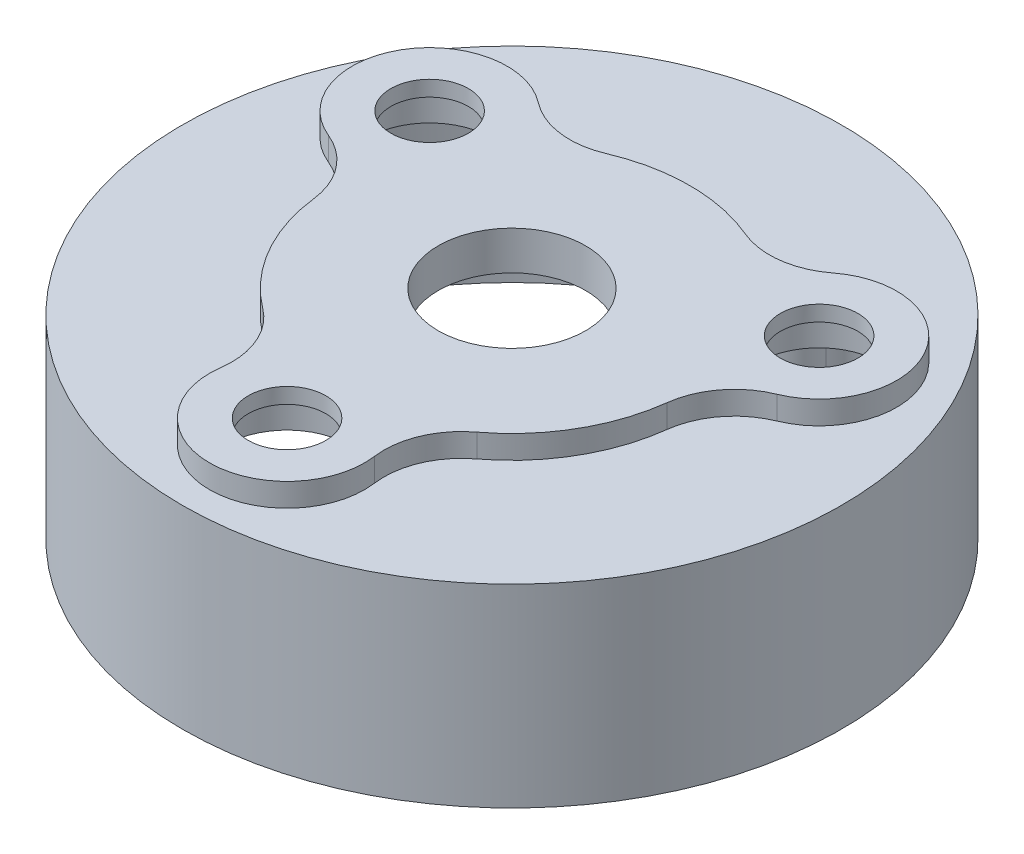
from build123d import *

# Parameters (mm, degrees)
SKETCH1_R                = 42.5
BOSS_EXTRUDE1_DEPTH      = 25
SKETCH2_R                = 22.945
BOSS_EXTRUDE2_DEPTH      = 3
SKETCH3_R                = 9.5
CUT_EXTRUDE1_DEPTH       = 99
SKETCH4_R                = 40.5
CUT_EXTRUDE2_DEPTH       = 23
BOSS_EXTRUDE5_DEPTH      = 2
BOSS_EXTRUDE5_DEPTH_BACK = 5
SKETCH6_R                = 10
CUT_EXTRUDE5_START       = 5
SKETCH8_R                = 8
CUT_EXTRUDE5_DEPTH       = 8
SKETCH9_R                = 5
CUT_EXTRUDE6_DEPTH       = 3
FILLET1_R                = 10
CUT_EXTRUDE3_DEPTH       = 65.354487155
CUT_EXTRUDE3_DEPTH_BACK  = 3
SKETCH5_R                = 20
SKETCH5_R_2              = 12.5
SKETCH12_R               = 6
SKETCH12_R_2             = 2
BOSS_EXTRUDE6_DEPTH      = 23
FILLET2_R                = 5


with BuildPart() as part:
    # Sketch1 → Boss-Extrude1 (new body)
    with BuildSketch(Plane(origin=(0, 0, 0), x_dir=(1, 0, 0), z_dir=(0, 1, 0))):
        with Locations(Location((0, 0, 0), (0, 0, 270))):
            Circle(SKETCH1_R)
    extrude(amount=BOSS_EXTRUDE1_DEPTH)

    # Sketch2 → Boss-Extrude2 (add)
    with BuildSketch(Plane(origin=(0, 25, 0), x_dir=(1, 0, 0), z_dir=(0, 1, 0))):
        with Locations(Location((0, 0, 0), (0, 0, 270))):
            Circle(SKETCH2_R)
    extrude(amount=BOSS_EXTRUDE2_DEPTH)

    # Sketch3 → Cut-Extrude1 (cut)
    with BuildSketch(Plane(origin=(0, 28, 0), x_dir=(1, 0, 0), z_dir=(0, 1, 0))):
        with Locations(Location((0, 0, 0), (0, 0, 270))):
            Circle(SKETCH3_R)
    extrude(amount=-CUT_EXTRUDE1_DEPTH, mode=Mode.SUBTRACT)

    # Sketch4 → Cut-Extrude2 (cut)
    with BuildSketch(Plane.XZ):
        with Locations(Location((0, 0, 0), (0, 0, 270))):
            Circle(SKETCH4_R)
    extrude(amount=-CUT_EXTRUDE2_DEPTH, mode=Mode.SUBTRACT)

    # Sketch6 → Boss-Extrude5 (add, two sides: drawn at the far end of the back side and taken through both)
    with BuildSketch(Plane(origin=(0, 23, 0), x_dir=(-1, 0, 0), z_dir=(0, -1, 0)).offset(-BOSS_EXTRUDE5_DEPTH_BACK)):
        with Locations(Location((25.11473671, 14.5, 0), (0, 0, 270))):
            Circle(SKETCH6_R)
        with Locations(Location((-25.11473671, 14.5, 0), (0, 0, 270))):
            Circle(SKETCH6_R)
        with Locations(Location((0, -29, 0), (0, 0, 270))):
            Circle(SKETCH6_R)
    extrude(amount=BOSS_EXTRUDE5_DEPTH + BOSS_EXTRUDE5_DEPTH_BACK)

    # Sketch8 → Cut-Extrude5 (cut)
    with BuildSketch(Plane.XZ.offset(-23).offset(CUT_EXTRUDE5_START)):
        with Locations(Location((0, 29, 0), (0, 0, 270))):
            Circle(SKETCH8_R)
        with Locations(Location((25.11473671, -14.5, 0), (0, 0, 270))):
            Circle(SKETCH8_R)
        with Locations(Location((-25.11473671, -14.5, 0), (0, 0, 270))):
            Circle(SKETCH8_R)
    extrude(amount=-CUT_EXTRUDE5_DEPTH, mode=Mode.SUBTRACT)

    # Sketch9 → Cut-Extrude6 (cut)
    with BuildSketch(Plane(origin=(0, 28, 0), x_dir=(1, 0, 0), z_dir=(0, 1, 0))):
        with Locations(Location((-25.11473671, 14.5, 0), (0, 0, 270))):
            Circle(SKETCH9_R)
        with Locations(Location((25.11473671, 14.5, 0), (0, 0, 270))):
            Circle(SKETCH9_R)
        with Locations(Location((0, -29, 0), (0, 0, 270))):
            Circle(SKETCH9_R)
    extrude(amount=-CUT_EXTRUDE6_DEPTH, mode=Mode.SUBTRACT)

    # Fillet1
    fillet1_edges = [part.edges().sort_by_distance(p)[0] for p in [
        (-15.428091514, 26.5, -16.983728014),
        (-22.422385668, 26.5, -4.869255176),
        (-6.994294154, 26.5, 21.85298319),
        (6.994294154, 26.5, 21.85298319),
        (22.422385668, 26.5, -4.869255176),
        (15.428091514, 26.5, -16.983728014),
    ]]
    fillet(fillet1_edges, radius=FILLET1_R)

    # Sketch5 → Cut-Extrude3 (cut, two sides: drawn at the far end of the back side and taken through both)
    with BuildSketch(Plane.XZ.offset(-23).offset(-CUT_EXTRUDE3_DEPTH_BACK)):
        with Locations(Location((0, 0, 0), (0, 0, 79.61563341))):
            Circle(SKETCH5_R)
        with Locations(Location((0, 0, 0), (0, 0, 90))):
            Circle(SKETCH5_R_2, mode=Mode.SUBTRACT)
    extrude(amount=CUT_EXTRUDE3_DEPTH + CUT_EXTRUDE3_DEPTH_BACK, mode=Mode.SUBTRACT)

    # Sketch12 → Boss-Extrude6 (add)
    # profile 1 of 3: a face of its own
    with BuildSketch(Plane.XZ.offset(-23)):
        with Locations((0, -35.5)):
            Circle(SKETCH12_R)
        with Locations(Location((0, -35.5, 0), (0, 0, 90))):
            Circle(SKETCH12_R_2, mode=Mode.SUBTRACT)
    # profile 2 of 3: a face of its own
    with BuildSketch(Plane.XZ.offset(-23)):
        with Locations((-30.743901834, 17.75)):
            Circle(SKETCH12_R)
        with Locations(Location((-30.743901834, 17.75, 0), (0, 0, 90))):
            Circle(SKETCH12_R_2, mode=Mode.SUBTRACT)
    # profile 3 of 3: a face of its own
    with BuildSketch(Plane.XZ.offset(-23)):
        with Locations((30.743901834, 17.75)):
            Circle(SKETCH12_R)
        with Locations(Location((30.743901834, 17.75, 0), (0, 0, 90))):
            Circle(SKETCH12_R_2, mode=Mode.SUBTRACT)
    extrude(amount=BOSS_EXTRUDE6_DEPTH)

    # Fillet2
    fillet2_edges = [part.edges().sort_by_distance(p)[0] for p in [
        (-3.539109012, 11.5, -40.345070423),
        (3.539109012, 11.5, -40.345070423),
        (-36.70941041, 11.5, 17.1075769),
        (-33.170301397, 11.5, 23.237493523),
        (33.170301397, 11.5, 23.237493523),
        (36.70941041, 11.5, 17.1075769),
    ]]
    fillet(fillet2_edges, radius=FILLET2_R)


solid = part.part
